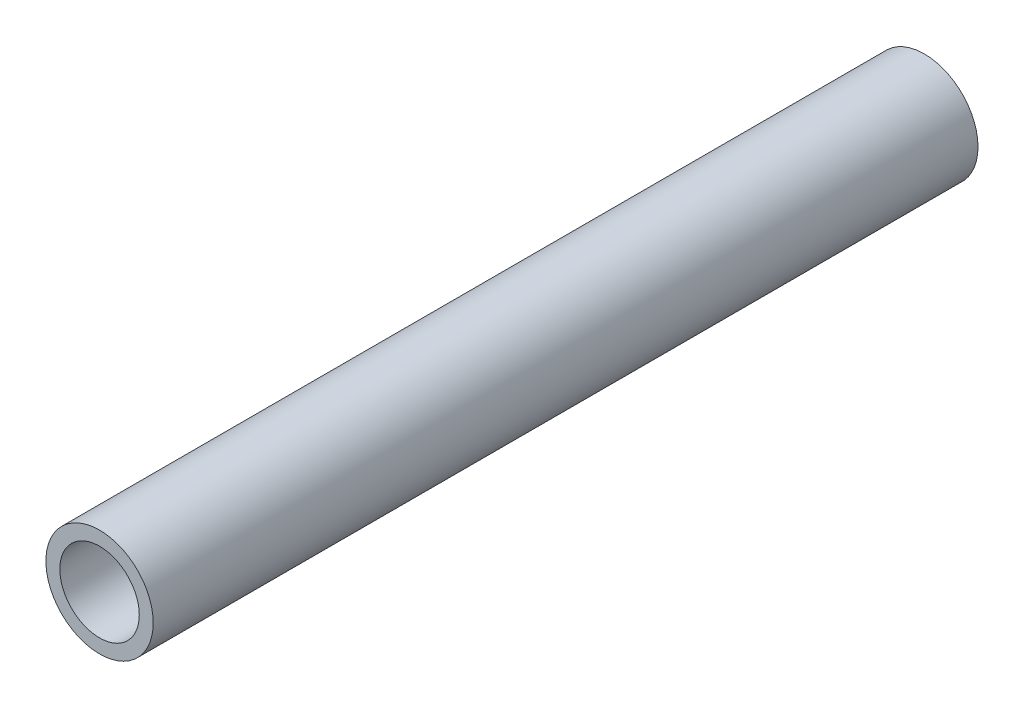
from build123d import *

# Parameters (mm, degrees)
SKETCH1_R           = 10.668
SKETCH1_R_2         = 7.8994
EXTRUDE_THIN1_DEPTH = 82


with BuildPart() as part:
    # Sketch1 → Extrude-Thin1 (new, symmetric)
    with BuildSketch(Plane.XY):
        Circle(SKETCH1_R)
        Circle(SKETCH1_R_2, mode=Mode.SUBTRACT)
    extrude(amount=EXTRUDE_THIN1_DEPTH, both=True)


solid = part.part
